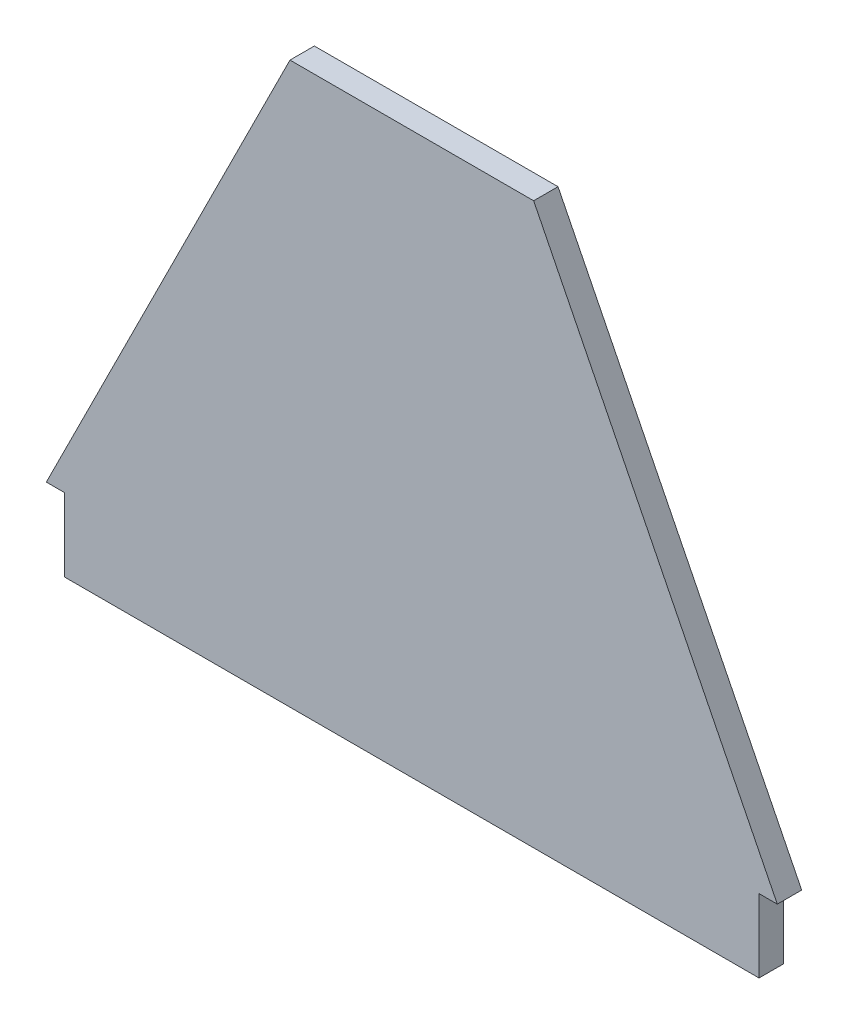
from build123d import *

# Parameters (mm, degrees)
BOSS_EXTRUDE1_DEPTH = 5


with BuildPart() as part:
    # Sketch1 → Boss-Extrude1 (new body)
    with BuildSketch(Plane.XY):
        Polygon((75, 11.725913897), (71.25, 11.725913897), (71.25, -3.274086103), (-71.25, -3.274086103), (-71.25, 11.725913897), (-75, 11.725913897), (-25, 111.725913897), (25, 111.725913897), align=None)
    extrude(amount=BOSS_EXTRUDE1_DEPTH)


solid = part.part
